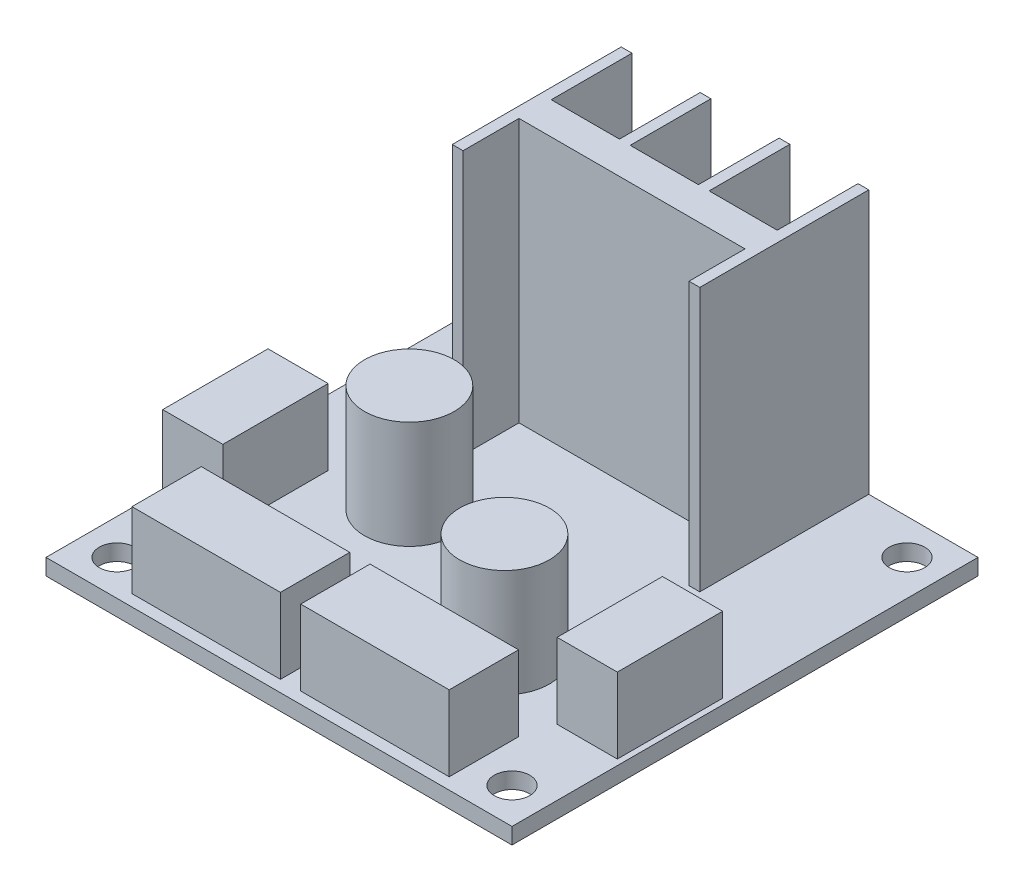
from build123d import *

# Parameters (mm, degrees)
SKETCH1_W           = 43.3
SKETCH1_H           = 43.3
SKETCH1_R           = 1.65
BOSS_EXTRUDE1_DEPTH = 1.5
SKETCH2_W           = 23
SKETCH2_H           = 15.7
BOSS_EXTRUDE2_DEPTH = 24.5
SKETCH3_W           = 5.591942039
SKETCH3_H           = 9.785898568
SKETCH3_W_2         = 13.797509161
SKETCH3_H_2         = 6.44288974
BOSS_EXTRUDE3_DEPTH = 7
SKETCH4_R           = 4.168434161
BOSS_EXTRUDE4_DEPTH = 10
SKETCH5_W           = 21
SKETCH5_H           = 5.2
SKETCH5_W_2         = 6.333333334
SKETCH5_H_2         = 15
SKETCH5_W_3         = 6.333333333
CUT_EXTRUDE1_DEPTH  = 24.5


with BuildPart() as part:
    # Sketch1 → Boss-Extrude1 (new body)
    with BuildSketch(Plane(origin=(0, 0, 0), x_dir=(1, 0, 0), z_dir=(0, 1, 0))):
        Rectangle(SKETCH1_W, SKETCH1_H)
        with Locations(Location((-18.35, 18.35, 0), (0, 0, 270))):
            Circle(SKETCH1_R, mode=Mode.SUBTRACT)
        with Locations(Location((18.35, 18.35, 0), (0, 0, 270))):
            Circle(SKETCH1_R, mode=Mode.SUBTRACT)
        with Locations(Location((-18.35, -18.35, 0), (0, 0, 270))):
            Circle(SKETCH1_R, mode=Mode.SUBTRACT)
        with Locations(Location((18.35, -18.35, 0), (0, 0, 270))):
            Circle(SKETCH1_R, mode=Mode.SUBTRACT)
    extrude(amount=BOSS_EXTRUDE1_DEPTH)

    # Sketch2 → Boss-Extrude2 (add)
    with BuildSketch(Plane(origin=(0, 1.5, 0), x_dir=(1, 0, 0), z_dir=(0, 1, 0))):
        with Locations((0, 13.8)):
            Rectangle(SKETCH2_W, SKETCH2_H)
    extrude(amount=BOSS_EXTRUDE2_DEPTH)

    # Sketch3 → Boss-Extrude3 (add)
    with BuildSketch(Plane(origin=(0, 1.5, 0), x_dir=(1, 0, 0), z_dir=(0, 1, 0))):
        with Locations((-18.325766573, -6.44288974)):
            Rectangle(SKETCH3_W, SKETCH3_H)
        with Locations((-7.84087525, -17.353254914)):
            Rectangle(SKETCH3_W_2, SKETCH3_H_2)
    boss_extrude3 = extrude(amount=BOSS_EXTRUDE3_DEPTH)

    # Mirror1: Boss-Extrude3 across plane
    add(boss_extrude3.mirror(Plane(origin=(0, 0, 0), x_dir=(0, 0, 1), z_dir=(1, 0, 0))))

    # Sketch4 → Boss-Extrude4 (add)
    with BuildSketch(Plane(origin=(0, 1.5, 0), x_dir=(1, 0, 0), z_dir=(0, 1, 0))):
        with Locations(Location((-8.592825404, -0.943272563, 0), (0, 0, 270))):
            Circle(SKETCH4_R)
        with Locations(Location((7.765846719, -8.463609984, 0), (0, 0, 270))):
            Circle(SKETCH4_R)
    extrude(amount=BOSS_EXTRUDE4_DEPTH)

    # Sketch5 → Cut-Extrude1 (cut)
    with BuildSketch(Plane(origin=(0, 26, 0), x_dir=(1, 0, 0), z_dir=(0, 1, 0))):
        with Locations((0, 8.55)):
            Rectangle(SKETCH5_W, SKETCH5_H)
        with Locations((0, 21.65)):
            Rectangle(SKETCH5_W_2, SKETCH5_H_2)
        with Locations((7.333333334, 21.65)):
            Rectangle(SKETCH5_W_3, SKETCH5_H_2)
        with Locations((-7.333333334, 21.65)):
            Rectangle(SKETCH5_W_3, SKETCH5_H_2)
    extrude(amount=-CUT_EXTRUDE1_DEPTH, mode=Mode.SUBTRACT)


solid = part.part
